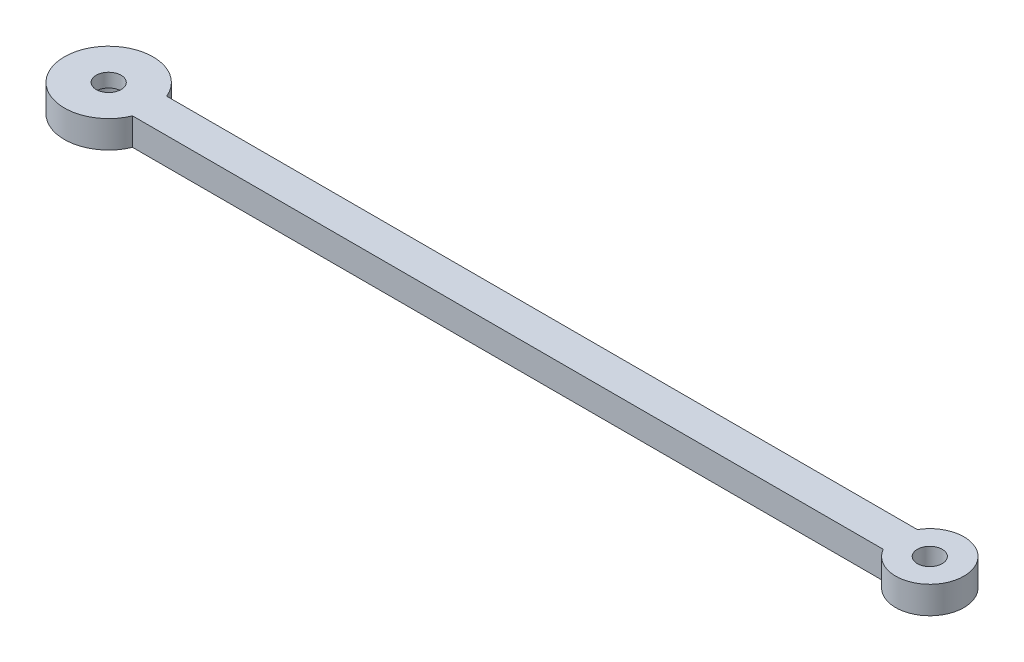
from build123d import *

# Parameters (mm, degrees)
BOSS_EXTRUDE1_DEPTH = 4
SKETCH3_R           = 3.5
CUT_EXTRUDE2_DEPTH  = 2
SKETCH2_R           = 1.825
CUT_EXTRUDE1_DEPTH  = 68.930111144


with BuildPart() as part:
    # Sketch1 → Boss-Extrude1 (new body)
    with BuildSketch(Plane(origin=(0, 0, 0), x_dir=(1, 0, 0), z_dir=(0, 1, 0))):
        with BuildLine():
            Line((-55, 2.5), (55, 2.5))
            ThreePointArc((55, 2.5), (64.330127019, 0), (55, -2.5))
            Line((55, -2.5), (-55, -2.5))
            ThreePointArc((-55, -2.5), (-67.5, 0), (-55, 2.5))
        make_face()
    extrude(amount=BOSS_EXTRUDE1_DEPTH)

    # Sketch3 → Cut-Extrude2 (cut)
    with BuildSketch(Plane.XZ):
        with Locations(Location((-61, 0, 0), (0, 0, 270))):
            Circle(SKETCH3_R)
    extrude(amount=-CUT_EXTRUDE2_DEPTH, mode=Mode.SUBTRACT)

    # Sketch2 → Cut-Extrude1 (cut, through all)
    with BuildSketch(Plane(origin=(0, 4, 0), x_dir=(1, 0, 0), z_dir=(0, 1, 0))):
        with Locations(Location((-61, 0, 0), (0, 0, 270))):
            Circle(SKETCH2_R)
        with Locations(Location((59.330127019, 0, 0), (0, 0, 270))):
            Circle(SKETCH2_R)
    extrude(amount=-CUT_EXTRUDE1_DEPTH, mode=Mode.SUBTRACT)


solid = part.part
